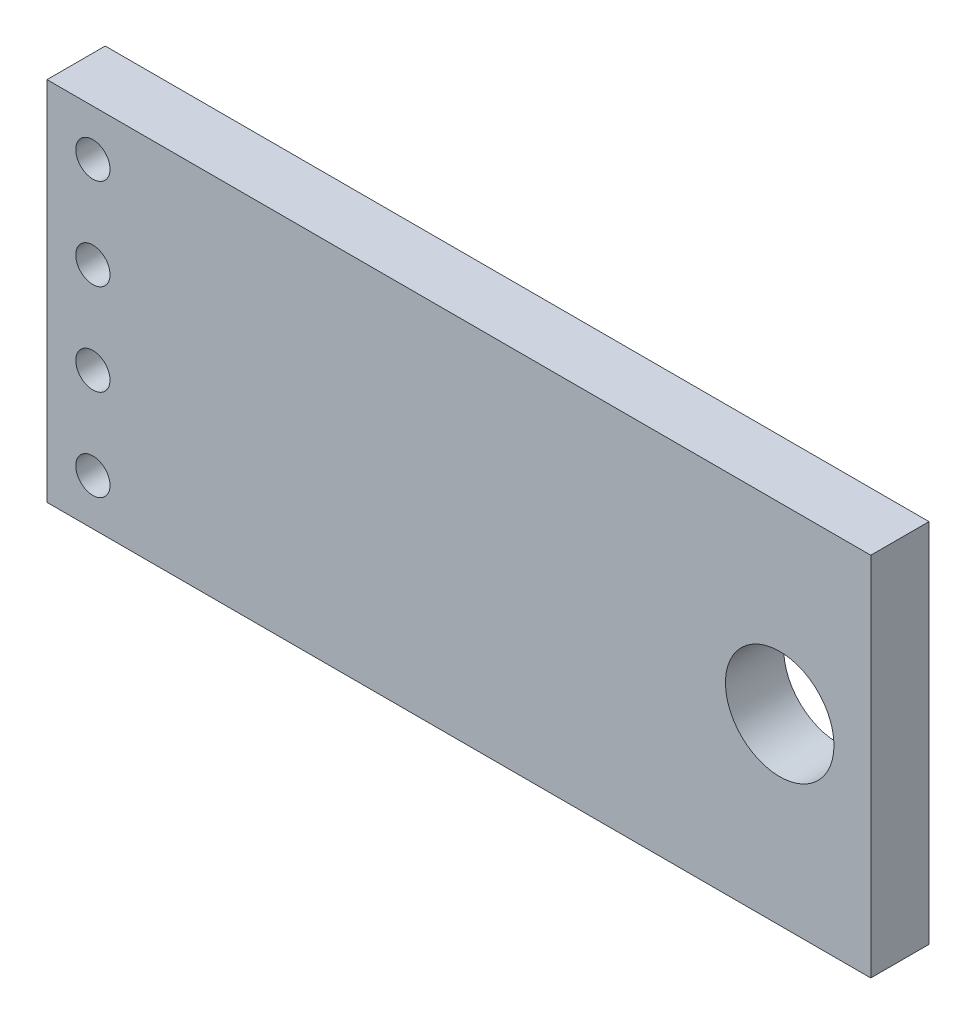
from build123d import *

# Parameters (mm, degrees)
SKETCH1_W           = 22.917169521
SKETCH1_H           = 10.185584258
SKETCH1_R           = 1.509847023
SKETCH1_R_2         = 0.476625594
BOSS_EXTRUDE1_DEPTH = 0.81


with BuildPart() as part:
    # Sketch1 → Boss-Extrude1 (new, symmetric)
    with BuildSketch(Plane.XY):
        with Locations((11.45856993, 5.092103028)):
            Rectangle(SKETCH1_W, SKETCH1_H)
        with Locations((20.383783826, 5.092103028)):
            Circle(SKETCH1_R, mode=Mode.SUBTRACT)
        with Locations((1.27648108, 8.902103028)):
            Circle(SKETCH1_R_2, mode=Mode.SUBTRACT)
        with Locations((1.27648108, 6.362103028)):
            Circle(SKETCH1_R_2, mode=Mode.SUBTRACT)
        with Locations((1.27648108, 3.822103028)):
            Circle(SKETCH1_R_2, mode=Mode.SUBTRACT)
        with Locations((1.27648108, 1.282103028)):
            Circle(SKETCH1_R_2, mode=Mode.SUBTRACT)
    extrude(amount=BOSS_EXTRUDE1_DEPTH, both=True)


solid = part.part
